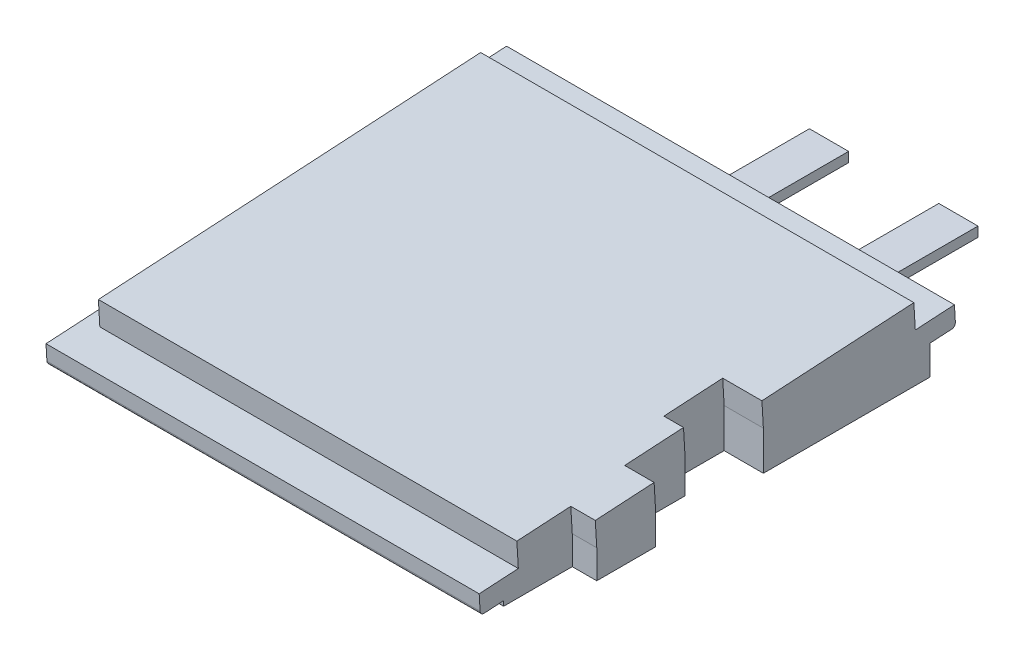
from build123d import *

# Parameters (mm, degrees)
BOSS_EXTRUDE1_DEPTH = 15.875
CUT_EXTRUDE1_DEPTH  = 195.237355702
BOSS_EXTRUDE2_DEPTH = 6.35
FILLET1_R           = 1.27
BOSS_EXTRUDE3_DEPTH = 7.9375
SKETCH5_W           = 12.7
SKETCH5_H           = 3.175
BOSS_EXTRUDE4_DEPTH = 40.9575


with BuildPart() as part:
    # Sketch1 → Boss-Extrude1 (new body)
    with BuildSketch(Plane(origin=(0, 0, 0), x_dir=(1, 0, 0), z_dir=(0, 1, 0))):
        Polygon((0, 0), (137.16, 0), (137.16, -53.975), (124.46, -53.975), (124.46, -73.025), (130.81, -73.025), (130.81, -92.075), (140.335, -92.075), (140.335, -111.125), (132.3975, -111.125), (132.3975, -133.35), (0, -133.35), align=None)
    extrude(amount=BOSS_EXTRUDE1_DEPTH)

    # Sketch2 → Cut-Extrude1 (cut, through all)
    with BuildSketch(Plane.ZY):
        Polygon((133.35, 7.9375), (133.35, 15.875), (0, 15.875), align=None)
    extrude(amount=-CUT_EXTRUDE1_DEPTH, mode=Mode.SUBTRACT)

    # Sketch3 → Boss-Extrude2 (add)
    with BuildSketch(Plane(origin=(0, 15.818952125, 0.941604293), x_dir=(1, 0, 0), z_dir=(0, 0.9982331517348171, 0.05941863998421531))):
        Polygon((-7.9375, 8.88077091), (137.16, 8.88077091), (137.16, -6.99422909), (7.9375, -6.99422909), (7.9375, -124.705255329), (132.3975, -124.705255329), (132.3975, -140.580255329), (-7.9375, -140.580255329), align=None)
    extrude(amount=-BOSS_EXTRUDE2_DEPTH)

    # Fillet1
    fillet1_edges = [part.edges().sort_by_distance(p)[0] for p in [
        (-7.9375, 5.567469486, 66.297691636),
        (64.61125, 10.007854941, -8.300784006),
        (62.23, 1.127084032, 140.896167278),
    ]]
    fillet(fillet1_edges, radius=FILLET1_R)

    # Sketch4 → Boss-Extrude3 (add)
    with BuildSketch(Plane(origin=(0, 15.818952125, 0.941604293), x_dir=(1, 0, 0), z_dir=(0, 0.9982331517348171, 0.05941863998421531))):
        Polygon((-3.175, -3.81922909), (103.849852773, -3.81922909), (137.16, -3.81922909), (137.16, -53.12726352), (124.46, -53.12726352), (124.46, -72.210981554), (130.81, -72.210981554), (130.81, -91.294699588), (140.335, -91.294699588), (140.335, -110.378417623), (132.3975, -110.378417623), (132.3975, -127.880255329), (-3.175, -127.880255329), align=None)
    extrude(amount=BOSS_EXTRUDE3_DEPTH)

    # Sketch5 → Boss-Extrude4 (add)
    with BuildSketch(Plane(origin=(0, 0, 0), x_dir=(-1, 0, 0), z_dir=(0, 0, -1))):
        with Locations((-63.5, 7.615385455)):
            Rectangle(SKETCH5_W, SKETCH5_H)
        with Locations((-105.41, 7.615385455)):
            Rectangle(SKETCH5_W, SKETCH5_H)
    extrude(amount=BOSS_EXTRUDE4_DEPTH)


solid = part.part
